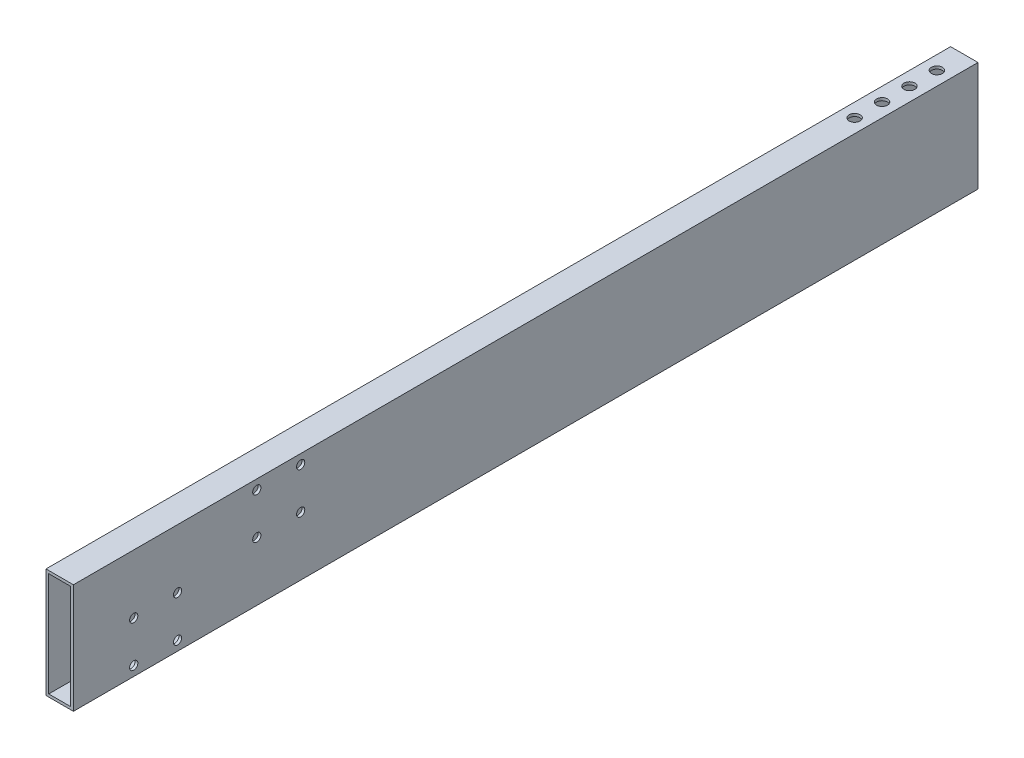
from build123d import *

# Parameters (mm, degrees)
SKETCH_1_W               = 10
SKETCH_1_H               = 40
SKETCH_1_W_2             = 8
SKETCH_1_H_2             = 38
EXTRUDE_1_DEPTH          = 330
SKETCH_3_R               = 1.5
CUT_EXTRUDE_2_DEPTH      = 10
CUT_EXTRUDE_4_DEPTH      = 333.565782966
CUT_EXTRUDE_4_DEPTH_BACK = 333.565782966
SKETCH_4_R               = 2


with BuildPart() as part:
    # 草图1 → 凸台-拉伸1 (new body)
    with BuildSketch(Plane.XY):
        with Locations((5, 20)):
            Rectangle(SKETCH_1_W, SKETCH_1_H)
        with Locations((5, 20)):
            Rectangle(SKETCH_1_W_2, SKETCH_1_H_2, mode=Mode.SUBTRACT)
    extrude(amount=EXTRUDE_1_DEPTH)

    # 草图3 → 切除-拉伸2 (cut)
    with BuildSketch(Plane(origin=(10, 0, 0), x_dir=(0, 0, -1), z_dir=(1, 0, 0))):
        with Locations((-308, 18.5)):
            Circle(SKETCH_3_R)
        with Locations((-292, 18.5)):
            Circle(SKETCH_3_R)
        with Locations((-292, 3.5)):
            Circle(SKETCH_3_R)
        with Locations((-308, 3.5)):
            Circle(SKETCH_3_R)
        with Locations((-263.1, 36.5)):
            Circle(SKETCH_3_R)
        with Locations((-247.1, 36.5)):
            Circle(SKETCH_3_R)
        with Locations((-263.1, 21.5)):
            Circle(SKETCH_3_R)
        with Locations((-247.1, 21.5)):
            Circle(SKETCH_3_R)
    extrude(amount=-CUT_EXTRUDE_2_DEPTH, mode=Mode.SUBTRACT)

    # 草图4 → 切除-拉伸4 (cut, two sides: drawn at the far end of the back side and taken through both)
    with BuildSketch(Plane(origin=(0, 40, 0), x_dir=(1, 0, 0), z_dir=(0, 1, 0)).offset(-CUT_EXTRUDE_4_DEPTH_BACK)):
        with Locations(Location((5, -10, 0), (0, 0, 90))):
            Circle(SKETCH_4_R)
        with Locations(Location((5, -20, 0), (0, 0, 90))):
            Circle(SKETCH_4_R)
        with Locations(Location((5, -30, 0), (0, 0, 90))):
            Circle(SKETCH_4_R)
        with Locations(Location((5, -40, 0), (0, 0, 90))):
            Circle(SKETCH_4_R)
    extrude(amount=CUT_EXTRUDE_4_DEPTH + CUT_EXTRUDE_4_DEPTH_BACK, mode=Mode.SUBTRACT)


solid = part.part
